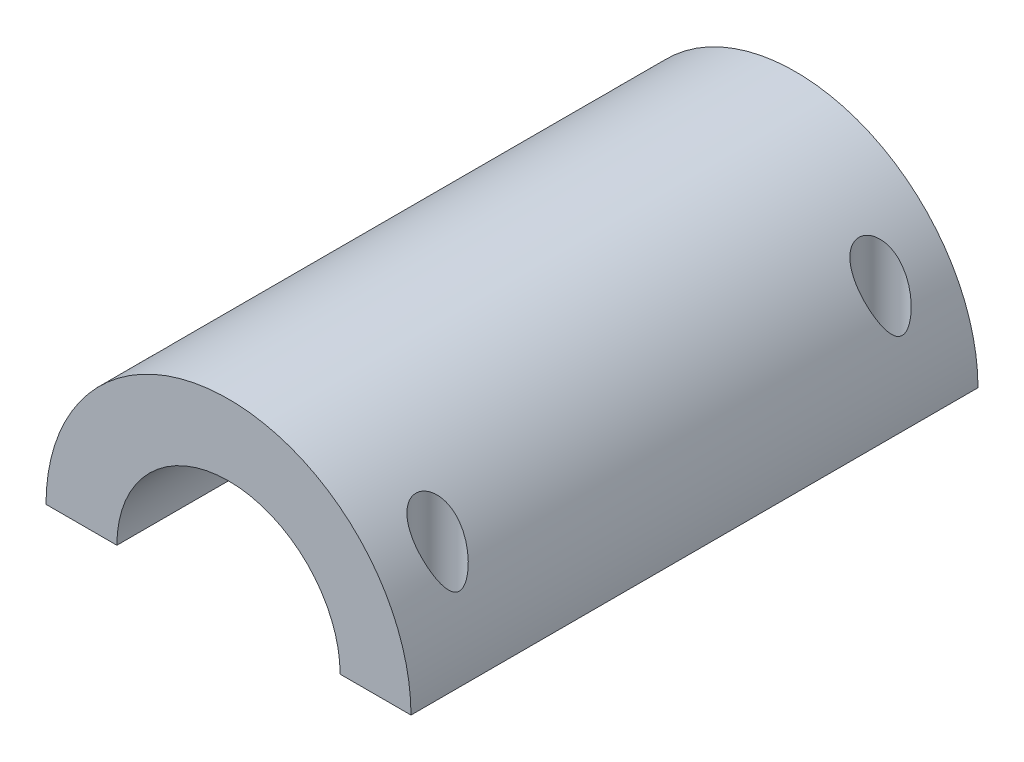
from build123d import *

# Parameters (mm, degrees)
BOSS_EXTRUDE1_DEPTH            = 32
CBORE_FOR_M3_SHCS1_D           = 4.9
CBORE_FOR_M3_SHCS1_CBORE_D     = 5.5
CBORE_FOR_M3_SHCS1_CBORE_DEPTH = 0.5


with BuildPart() as part:
    # Sketch1 → Boss-Extrude1 (new, symmetric)
    with BuildSketch(Plane.XY):
        with BuildLine():
            Line((-20.6, 0), (-12.6, 0))
            ThreePointArc((-12.6, 0), (0, 12.6), (12.6, 0))
            Line((12.6, 0), (20.6, 0))
            ThreePointArc((20.6, 0), (0, 20.6), (-20.6, 0))
        make_face()
    extrude(amount=BOSS_EXTRUDE1_DEPTH, both=True)

    # CBORE for M3 SHCS1 (through all)
    with Locations(Plane.XZ):
        with Locations((-16.6, -25), (16.6, 25), (-16.6, 25), (16.6, -25)):
            CounterBoreHole(CBORE_FOR_M3_SHCS1_D / 2, CBORE_FOR_M3_SHCS1_CBORE_D / 2, CBORE_FOR_M3_SHCS1_CBORE_DEPTH)


solid = part.part
